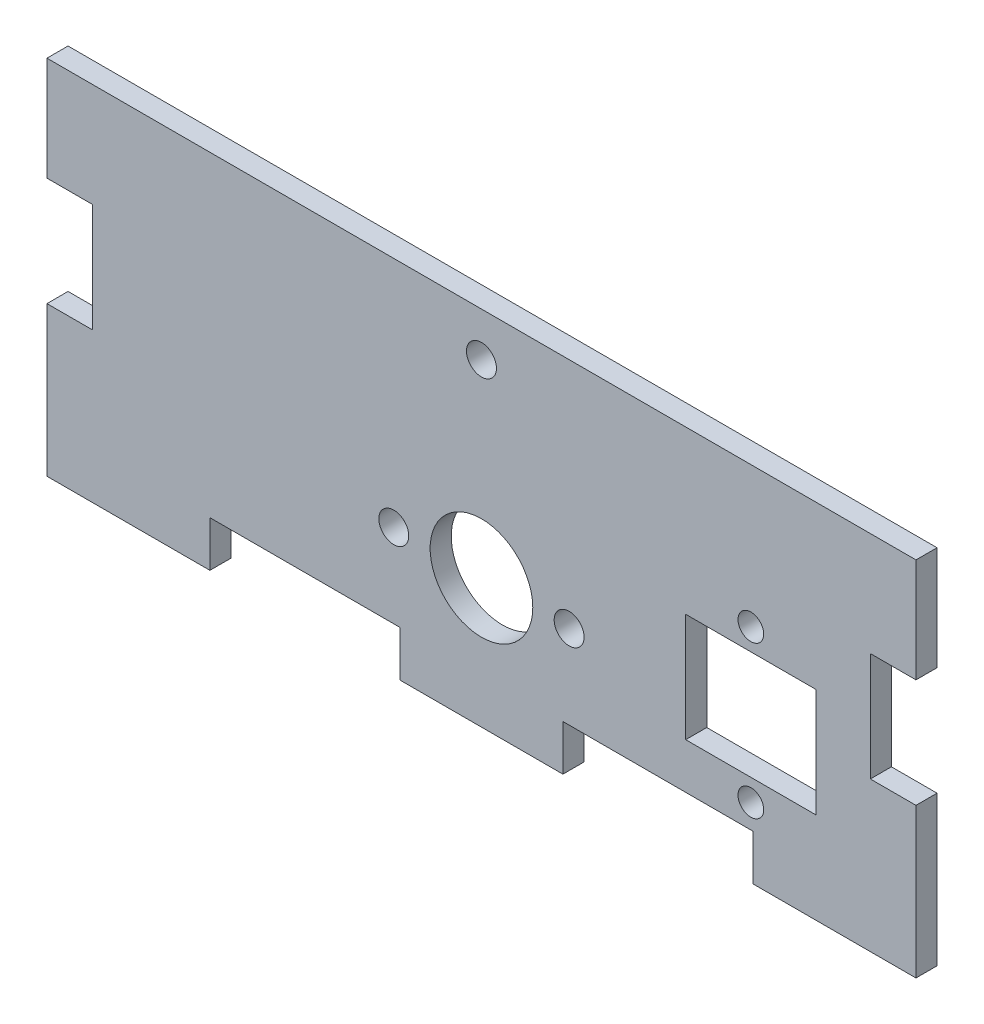
from build123d import *

# Parameters (mm, degrees)
SKETCH1_W            = 101.6
SKETCH1_H            = 37
BASE_SHAPE_DEPTH     = 2.4638
SKETCH2_R            = 6
SKETCH2_R_2          = 1.75
MOTOR_HOLES_DEPTH    = 55.11986983
SKETCH4_W            = 19.05
SKETCH4_H            = 2.4638
BOTTOM_TEETH_DEPTH   = 5.334
SKETCH5_W            = 5.334
SKETCH5_H            = 12.7
SIDE_SLOTS_DEPTH     = 57.167338075
SKETCH7_W            = 15.24
SKETCH7_H            = 12.7
ENCODER_CUTOUT_DEPTH = 72.809068434
SKETCH8_R            = 1.5
ENCODER_MOUNTS_DEPTH = 57.167338075


with BuildPart() as part:
    # Sketch1 → Base Shape (new body)
    with BuildSketch(Plane.XY):
        Rectangle(SKETCH1_W, SKETCH1_H)
    extrude(amount=-BASE_SHAPE_DEPTH)

    # Sketch2 → Motor Holes (cut, through all)
    with BuildSketch(Plane.XY):
        with Locations((0, -8.73)):
            Circle(SKETCH2_R)
        with Locations((-10.25, -8.73)):
            Circle(SKETCH2_R_2)
        with Locations((10.25, -8.73)):
            Circle(SKETCH2_R_2)
        with Locations((0, 13.369999996)):
            Circle(SKETCH2_R_2)
    extrude(amount=-MOTOR_HOLES_DEPTH, mode=Mode.SUBTRACT)

    # Sketch4 → Bottom teeth (add)
    with BuildSketch(Plane.XZ.offset(18.5)):
        with Locations((-41.275, -1.2319)):
            Rectangle(SKETCH4_W, SKETCH4_H)
        with Locations((0, -1.2319)):
            Rectangle(SKETCH4_W, SKETCH4_H)
        with Locations((41.275, -1.2319)):
            Rectangle(SKETCH4_W, SKETCH4_H)
    extrude(amount=BOTTOM_TEETH_DEPTH)

    # Sketch5 → Side Slots (cut, through all)
    with BuildSketch(Plane.XY):
        with Locations((48.133, 0)):
            Rectangle(SKETCH5_W, SKETCH5_H)
        with Locations((-48.133, 0)):
            Rectangle(SKETCH5_W, SKETCH5_H)
    extrude(amount=-SIDE_SLOTS_DEPTH, mode=Mode.SUBTRACT)

    # Sketch7 → Encoder Cutout (cut, through all)
    with BuildSketch(Plane(origin=(16.243120564, -7.106483242, 0), x_dir=(1, 0, 0), z_dir=(0, 0, 1))):
        with Locations((15.252879436, 0.290483242)):
            Rectangle(SKETCH7_W, SKETCH7_H)
    extrude(amount=-ENCODER_CUTOUT_DEPTH, mode=Mode.SUBTRACT)

    # Sketch8 → Encoder Mounts (cut, through all)
    with BuildSketch(Plane.XY):
        with Locations((31.496, 2.074)):
            Circle(SKETCH8_R)
        with Locations((31.496, -15.706)):
            Circle(SKETCH8_R)
    extrude(amount=-ENCODER_MOUNTS_DEPTH, mode=Mode.SUBTRACT)


solid = part.part
